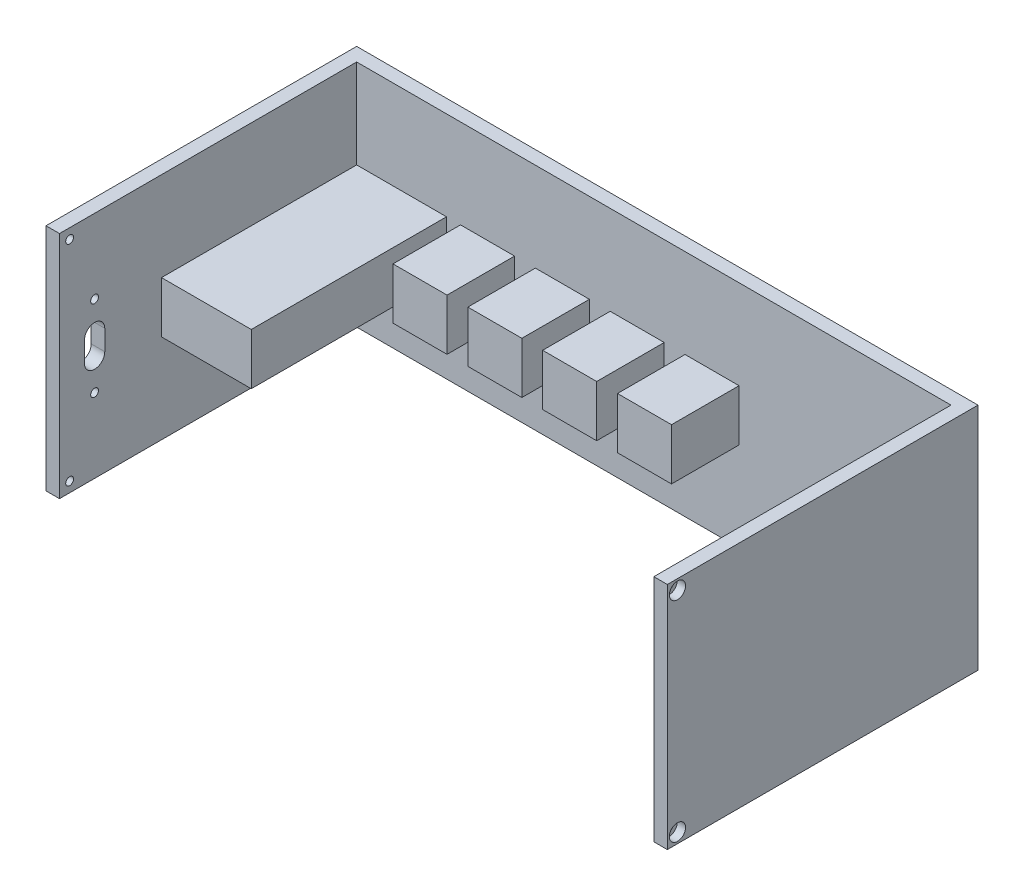
from build123d import *

# Parameters (mm, degrees)
BOSS_EXTRUDE1_DEPTH = 5
SKETCH2_W           = 5
SKETCH2_H           = 85
BOSS_EXTRUDE3_DEPTH = 110
SKETCH2_3_W         = 20
SKETCH2_3_H         = 19
BOSS_EXTRUDE4_DEPTH = 25
SKETCH3_R           = 1.45
CUT_EXTRUDE1_DEPTH  = 5
SKETCH4_R           = 1.45
CUT_EXTRUDE2_DEPTH  = 5
SKETCH5_R           = 3
SKETCH5_R_2         = 1.45
CUT_EXTRUDE3_DEPTH  = 3.1
SKETCH5_2_R         = 1.45
CUT_EXTRUDE4_DEPTH  = 5
CUT_EXTRUDE5_START  = -5
SKETCH6_R           = 1.45
CUT_EXTRUDE5_DEPTH  = 5
SKETCH2_7_W         = 33.25
SKETCH2_7_H         = 19
BOSS_EXTRUDE6_DEPTH = 72.25


with BuildPart() as part:
    # Sketch1 → Boss-Extrude1 (new body)
    with BuildSketch(Plane(origin=(0, 0, 0), x_dir=(0, 1, 0), z_dir=(0, 0, 1))):
        Polygon((-42.5, 94.306537639), (-42.5, -115), (42.5, -115), (42.5, 94.306537639), (42.5, 115), (-42.5, 115), align=None)
    extrude(amount=BOSS_EXTRUDE1_DEPTH)

    # Sketch2 → Boss-Extrude3 (add)
    with BuildSketch(Plane.XY.offset(5)):
        with Locations((-112.5, 0)):
            Rectangle(SKETCH2_W, SKETCH2_H)
        with Locations((112.5, 0)):
            Rectangle(SKETCH2_W, SKETCH2_H)
    extrude(amount=BOSS_EXTRUDE3_DEPTH)

    # Sketch2<3> → Boss-Extrude4 (add)
    with BuildSketch(Plane.XY.offset(5)):
        with Locations((-61.55, 0)):
            Rectangle(SKETCH2_3_W, SKETCH2_3_H)
        with Locations((-33.85, 0)):
            Rectangle(SKETCH2_3_W, SKETCH2_3_H)
        with Locations((-6.15, 0)):
            Rectangle(SKETCH2_3_W, SKETCH2_3_H)
        with Locations((21.55, 0)):
            Rectangle(SKETCH2_3_W, SKETCH2_3_H)
    extrude(amount=BOSS_EXTRUDE4_DEPTH)

    # Sketch3 → Cut-Extrude1 (cut)
    with BuildSketch(Plane(origin=(-115, 0, 0), x_dir=(0, -1, 0), z_dir=(-1, 0, 0))):
        with Locations((-15, 102)):
            Circle(SKETCH3_R)
        with Locations((15, 102)):
            Circle(SKETCH3_R)
        with BuildLine():
            Line((-3.75, 105.75), (3.75, 105.75))
            ThreePointArc((3.75, 105.75), (7.5, 102), (3.75, 98.25))
            Line((3.75, 98.25), (-3.75, 98.25))
            ThreePointArc((-3.75, 98.25), (-7.5, 102), (-3.75, 105.75))
        make_face()
    extrude(amount=-CUT_EXTRUDE1_DEPTH, mode=Mode.SUBTRACT)

    # Sketch4 → Cut-Extrude2 (cut)
    with BuildSketch(Plane.XY.offset(5)):
        with Locations((-47.7, 0)):
            Circle(SKETCH4_R)
        with Locations((7.181418717, 0)):
            Circle(SKETCH4_R)
    extrude(amount=-CUT_EXTRUDE2_DEPTH, mode=Mode.SUBTRACT)

    # Sketch5 → Cut-Extrude3 (cut)
    # profile 1 of 2: a face of its own
    with BuildSketch(Plane.YZ.offset(115)):
        with Locations(Location((-38.75, 111.25, 0), (0, 0, 270))):
            Circle(SKETCH5_R)
        with Locations(Location((-38.75, 111.25, 0), (0, 0, 270))):
            Circle(SKETCH5_R_2, mode=Mode.SUBTRACT)
    # profile 2 of 2: a face of its own
    with BuildSketch(Plane.YZ.offset(115)):
        with Locations(Location((38.75, 111.25, 0), (0, 0, 270))):
            Circle(SKETCH5_R)
        with Locations(Location((38.75, 111.25, 0), (0, 0, 270))):
            Circle(SKETCH5_R_2, mode=Mode.SUBTRACT)
    extrude(amount=-CUT_EXTRUDE3_DEPTH, mode=Mode.SUBTRACT)

    # Sketch5<2> → Cut-Extrude4 (cut)
    with BuildSketch(Plane.YZ.offset(115)):
        with Locations(Location((-38.75, 111.25, 0), (0, 0, 270))):
            Circle(SKETCH5_2_R)
        with Locations(Location((38.75, 111.25, 0), (0, 0, 270))):
            Circle(SKETCH5_2_R)
    extrude(amount=-CUT_EXTRUDE4_DEPTH, mode=Mode.SUBTRACT)

    # Sketch6 → Cut-Extrude5 (cut)
    with BuildSketch(Plane(origin=(-115, 0, 0), x_dir=(0, -1, 0), z_dir=(-1, 0, 0)).offset(CUT_EXTRUDE5_START)):
        with Locations(Location((-38.75, 111.25, 0), (0, 0, 270))):
            Circle(SKETCH6_R)
        with Locations(Location((38.75, 111.25, 0), (0, 0, 270))):
            Circle(SKETCH6_R)
    extrude(amount=CUT_EXTRUDE5_DEPTH, mode=Mode.SUBTRACT)

    # Sketch2<7> → Boss-Extrude6 (add)
    with BuildSketch(Plane.XY.offset(5)):
        with Locations((-93.375, 0)):
            Rectangle(SKETCH2_7_W, SKETCH2_7_H)
    extrude(amount=BOSS_EXTRUDE6_DEPTH)


solid = part.part
